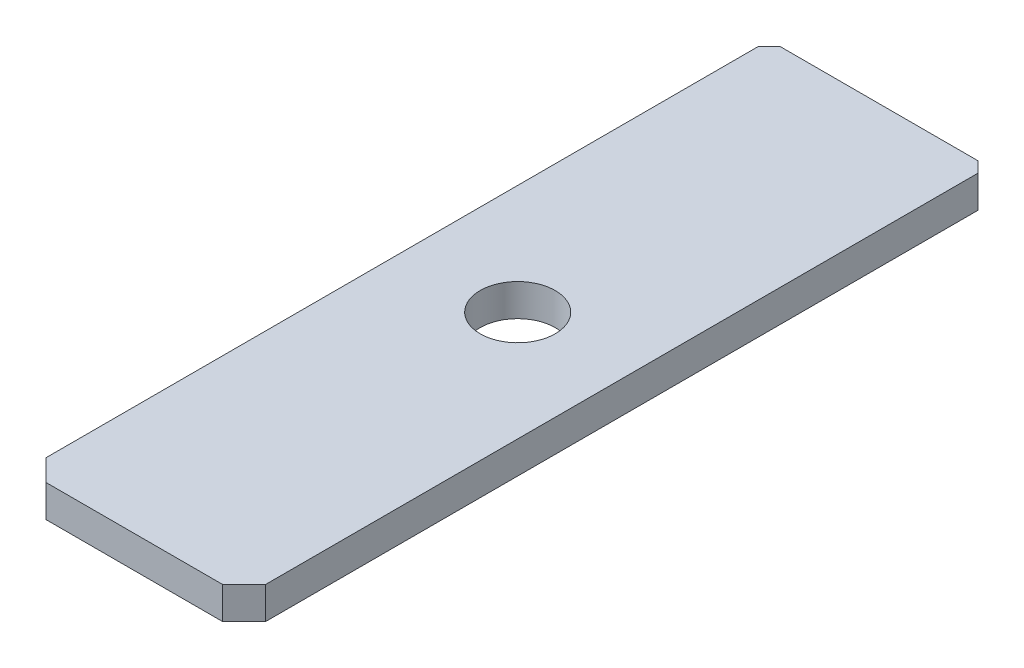
from build123d import *

# Parameters (mm, degrees)
SKETCH1_W           = 10.24
SKETCH1_H           = 34.73
BOSS_EXTRUDE1_DEPTH = 1.5
CHAMFER1_SIZE       = 0.5
CHAMFER2_SIZE       = 1
SKETCH2_R           = 1.75
CUT_EXTRUDE1_DEPTH  = 19.166111995


with BuildPart() as part:
    # Sketch1 → Boss-Extrude1 (new body)
    with BuildSketch(Plane(origin=(0, 0, 0), x_dir=(1, 0, 0), z_dir=(0, 1, 0))):
        Rectangle(SKETCH1_W, SKETCH1_H)
    extrude(amount=BOSS_EXTRUDE1_DEPTH)

    # Chamfer1
    chamfer1_edges = [part.edges().sort_by_distance(p)[0] for p in [
        (-5.12, 0.75, -17.365),
        (5.12, 0.75, -17.365),
    ]]
    chamfer(chamfer1_edges, length=CHAMFER1_SIZE)

    # Chamfer2
    chamfer2_edges = [part.edges().sort_by_distance(p)[0] for p in [
        (5.12, 0.75, 17.365),
        (-5.12, 0.75, 17.365),
    ]]
    chamfer(chamfer2_edges, length=CHAMFER2_SIZE)

    # Sketch2 → Cut-Extrude1 (cut, through all)
    with BuildSketch(Plane(origin=(0, 1.5, 0), x_dir=(1, 0, 0), z_dir=(0, 1, 0))):
        with Locations(Location((0, 0.515, 0), (0, 0, 270))):
            Circle(SKETCH2_R)
    extrude(amount=-CUT_EXTRUDE1_DEPTH, mode=Mode.SUBTRACT)


solid = part.part
